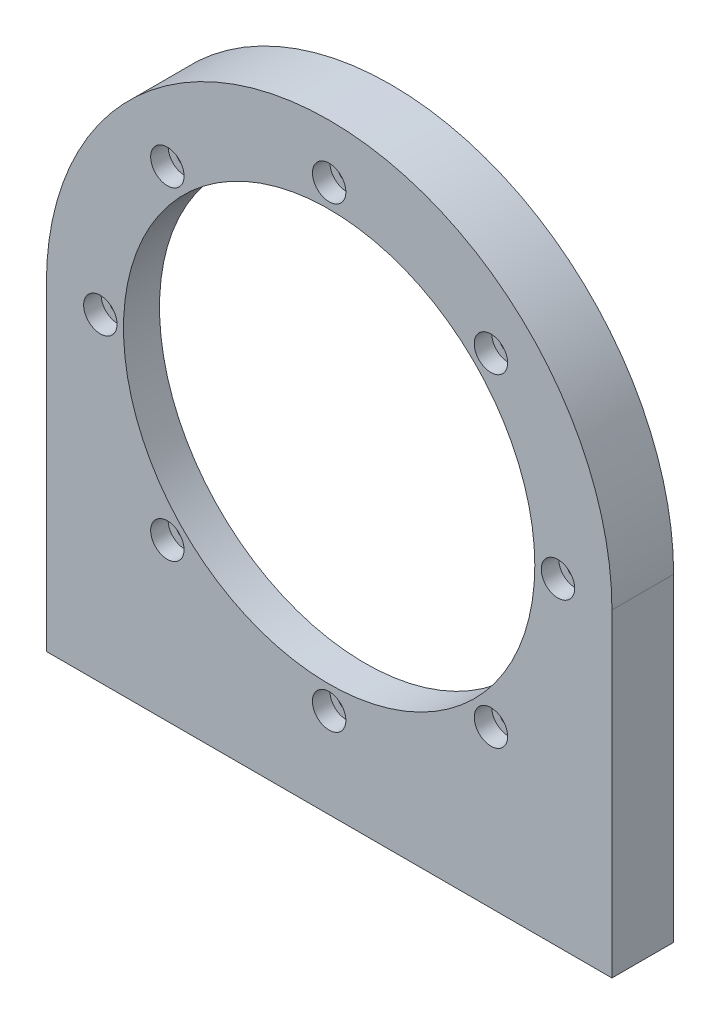
from build123d import *

# Parameters (mm, degrees)
SKETCH1_R                                           = 55
SKETCH1_R_2                                         = 40
BOSS_EXTRUDE1_DEPTH                                 = 7
CBORE_FOR_M3_HEX_SOCKET_HEAD_CAP_SCREW1_D           = 3.4
CBORE_FOR_M3_HEX_SOCKET_HEAD_CAP_SCREW1_CBORE_D     = 6.5
CBORE_FOR_M3_HEX_SOCKET_HEAD_CAP_SCREW1_CBORE_DEPTH = 3.4
BOSS_EXTRUDE3_START                                 = 5
SKETCH4_R                                           = 55
SKETCH4_R_2                                         = 50
BOSS_EXTRUDE3_DEPTH                                 = 5
BOSS_EXTRUDE4_START                                 = -12
BOSS_EXTRUDE4_DEPTH                                 = 12
TAP_DRILL_FOR_M3_HELICOIL1_D                        = 3.15
TAP_DRILL_FOR_M3_HELICOIL1_DEPTH                    = 10
TAP_DRILL_FOR_M3_HELICOIL1_TIP                      = 0.946355475


with BuildPart() as part:
    # Sketch1 → Boss-Extrude1 (new body)
    with BuildSketch(Plane.XY):
        Circle(SKETCH1_R)
        Circle(SKETCH1_R_2, mode=Mode.SUBTRACT)
    extrude(amount=BOSS_EXTRUDE1_DEPTH)

    # CBORE for M3 Hex Socket Head Cap Screw1 (through all)
    with Locations(Plane.XY.offset(7)):
        with Locations((-31.466251763, 31.466251763), (0, 44.5), (31.466251763, 31.466251763), (44.5, 0), (31.466251763, -31.466251763), (0, -44.5), (-31.466251763, -31.466251763), (-44.5, 0)):
            CounterBoreHole(CBORE_FOR_M3_HEX_SOCKET_HEAD_CAP_SCREW1_D / 2, CBORE_FOR_M3_HEX_SOCKET_HEAD_CAP_SCREW1_CBORE_D / 2, CBORE_FOR_M3_HEX_SOCKET_HEAD_CAP_SCREW1_CBORE_DEPTH)

    # Sketch4 → Boss-Extrude3 (add)
    with BuildSketch(Plane(origin=(0, 0, 0), x_dir=(-1, 0, 0), z_dir=(0, 0, -1)).offset(BOSS_EXTRUDE3_START)):
        Circle(SKETCH4_R)
        Circle(SKETCH4_R_2, mode=Mode.SUBTRACT)
    extrude(amount=-BOSS_EXTRUDE3_DEPTH)

    # Sketch5 → Boss-Extrude4 (add)
    with BuildSketch(Plane.XY.offset(7).offset(BOSS_EXTRUDE4_START)):
        with BuildLine():
            Line((-55, 0), (-55, -62))
            Line((-55, -62), (55, -62))
            Line((55, -62), (55, 0))
            ThreePointArc((55, 0), (0, -55), (-55, 0))
        make_face()
    extrude(amount=BOSS_EXTRUDE4_DEPTH)

    # Tap Drill for M3 Helicoil1
    with Locations(Plane(origin=(0, -62, 0), x_dir=(-1, 0, 0), z_dir=(0, -1, 0))):
        with Locations((-50, -1), (0, -1), (25, -1), (50, -1), (-25, -1)):
            Hole(TAP_DRILL_FOR_M3_HELICOIL1_D / 2, depth=TAP_DRILL_FOR_M3_HELICOIL1_DEPTH)
            with Locations((0, 0, -(TAP_DRILL_FOR_M3_HELICOIL1_DEPTH + TAP_DRILL_FOR_M3_HELICOIL1_TIP / 2))):  # 118° drill point
                Cone(0, TAP_DRILL_FOR_M3_HELICOIL1_D / 2, TAP_DRILL_FOR_M3_HELICOIL1_TIP, mode=Mode.SUBTRACT)


solid = part.part
